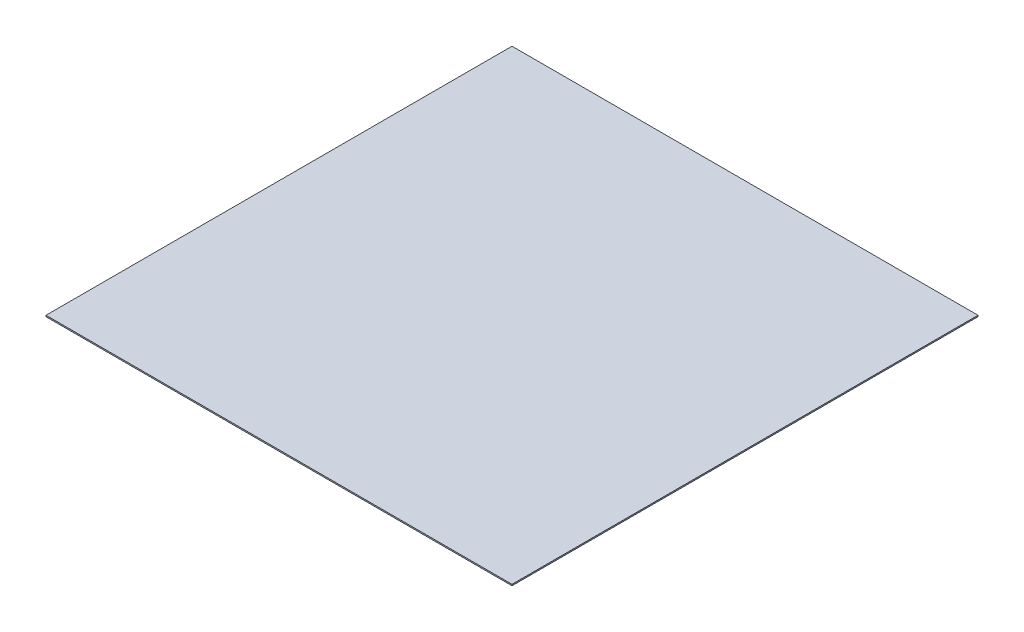
from build123d import *

# Parameters (mm, degrees)
CROQUIS1_W              = 25
CROQUIS1_H              = 25
SALIENTE_EXTRUIR1_DEPTH = 0.07


with BuildPart() as part:
    # Croquis1 → Saliente-Extruir1 (new body)
    with BuildSketch(Plane(origin=(0, 0, 0), x_dir=(1, 0, 0), z_dir=(0, 1, 0))):
        with Locations((12.5, 12.5)):
            Rectangle(CROQUIS1_W, CROQUIS1_H)
    extrude(amount=SALIENTE_EXTRUIR1_DEPTH)


solid = part.part
